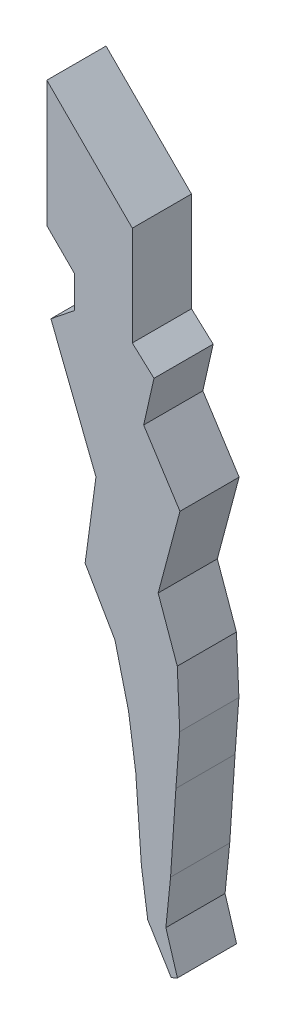
from build123d import *

# Parameters (mm, degrees)
AUFSATZ_LINEAR_AUSTRAGEN1_DEPTH = 3


with BuildPart() as part:
    # Model → Aufsatz-Linear austragen1 (new body)
    with BuildSketch(Plane.XY):
        Polygon((0.1, 36.376910644), (0.1, 29.988945377), (1.490718, 28.598228377), (1.490718, 26.955566815), (0.305264989, 26.005804098), (2.589671063, 20.205075454), (2.040099248, 16.140768205), (3.551965251, 13.52717356), (4.240634577, 10.755848785), (4.606213, 8.233847104), (4.893947442, 4.282729041), (5.214057616, 2.072507117), (6.404079879, 0.12754237), (6.71930093, 0.270359545), (6.133826966, 2.189415456), (6.370504233, 4.523406601), (6.641613576, 8.553675635), (6.835226074, 11.142689493), (6.711022821, 13.955587557), (5.742113085, 16.682727508), (6.847782624, 20.823490567), (5.007398507, 23.691207376), (5.530761218, 26.003096802), (4.431541, 27.00617453), (4.431541, 32.045369644), align=None)
    extrude(amount=AUFSATZ_LINEAR_AUSTRAGEN1_DEPTH)


solid = part.part
